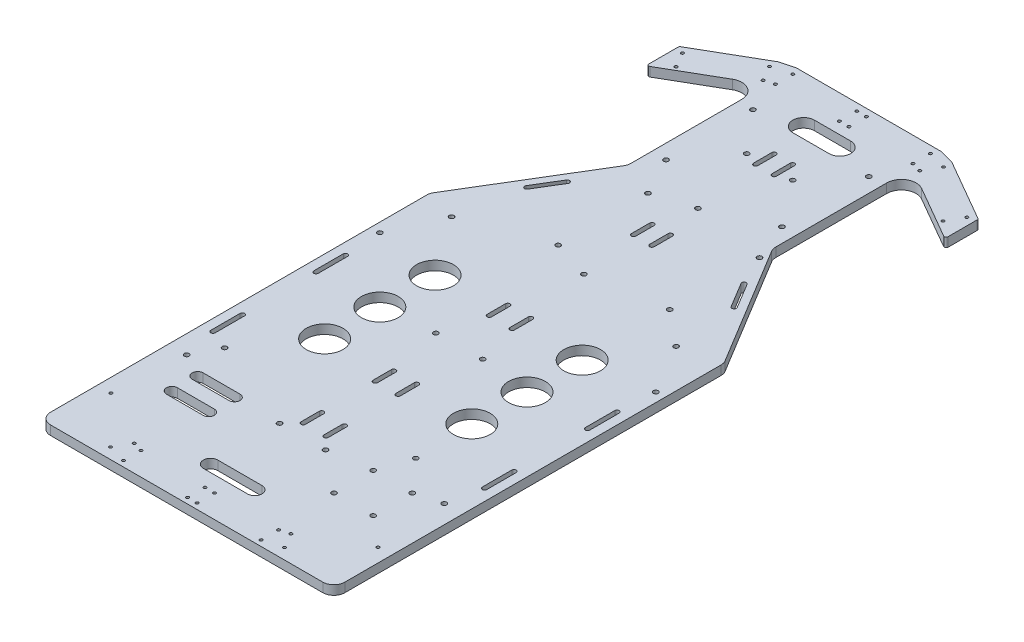
from build123d import *

# Parameters (mm, degrees)
SKETCH1_R           = 1
SKETCH1_R_2         = 1.651
SKETCH1_R_3         = 12.7
SKETCH1_R_4         = 0.999998
BOSS_EXTRUDE1_DEPTH = 6.35
FILLET1_R           = 7.62
FILLET2_R           = 1.27
FILLET3_R           = 10.16


with BuildPart() as part:
    # Sketch1 → Boss-Extrude1 (new body)
    with BuildSketch(Plane(origin=(0, 0, 0), x_dir=(1, 0, 0), z_dir=(0, 1, 0))):
        Polygon((46.413279514, 335.441646668), (-53.531215173, 335.441646668), (-63.531215173, 332.762154744), (-106.832485363, 307.762154744), (-106.832485363, 284.668143976), (-53.586720486, 315.44164674), (-53.586720486, 219.105229304), (-105.15896783, 133.894172723), (-105.15896783, -135.4993116), (98.04103217, -135.4993116), (98.04103217, 133.894172723), (46.413279514, 219.105229304), (46.413279514, 315.441646668), (99.714549703, 284.668143976), (99.714549703, 307.762154744), (56.413279514, 332.762154744), align=None)
        with Locations(Location((-95.734409151, -95.63834608, 0), (0, 0, 270))):
            Circle(SKETCH1_R, mode=Mode.SUBTRACT)
        with Locations(Location((-63.629291385, -128.030650925, 0), (0, 0, 270))):
            Circle(SKETCH1_R, mode=Mode.SUBTRACT)
        with Locations(Location((-57.629291385, -117.63834608, 0), (0, 0, 270))):
            Circle(SKETCH1_R, mode=Mode.SUBTRACT)
        with Locations(Location((-92.45896783, -46.5993116, 0), (0, 0, 270))):
            Circle(SKETCH1_R_2, mode=Mode.SUBTRACT)
        with Locations(Location((-83.55896783, -29.323827277, 0), (0, 0, 270))):
            Circle(SKETCH1_R_2, mode=Mode.SUBTRACT)
        with BuildLine():
            ThreePointArc((-75.94896783, -77.0793116), (-79.75896783, -73.2693116), (-75.94896783, -69.4593116))
            Line((-75.94896783, -69.4593116), (-50.54896783, -69.4593116))
            ThreePointArc((-50.54896783, -69.4593116), (-46.73896783, -73.2693116), (-50.54896783, -77.0793116))
            Line((-50.54896783, -77.0793116), (-75.94896783, -77.0793116))
        make_face(mode=Mode.SUBTRACT)
        with BuildLine():
            ThreePointArc((-75.94896783, -59.2993116), (-79.75896783, -55.4893116), (-75.94896783, -51.6793116))
            Line((-75.94896783, -51.6793116), (-50.54896783, -51.6793116))
            ThreePointArc((-50.54896783, -51.6793116), (-46.73896783, -55.4893116), (-50.54896783, -59.2993116))
            Line((-50.54896783, -59.2993116), (-75.94896783, -59.2993116))
        make_face(mode=Mode.SUBTRACT)
        with Locations(Location((-51.031215173, -131.540269868, 0), (0, 0, 270))):
            Circle(SKETCH1_R, mode=Mode.SUBTRACT)
        with Locations(Location((-51.031215173, -119.540269868, 0), (0, 0, 270))):
            Circle(SKETCH1_R, mode=Mode.SUBTRACT)
        with Locations(Location((-6.85896783, -131.540269868, 0), (0, 0, 270))):
            Circle(SKETCH1_R, mode=Mode.SUBTRACT)
        with Locations(Location((-6.85896783, -119.540269868, 0), (0, 0, 270))):
            Circle(SKETCH1_R, mode=Mode.SUBTRACT)
        with Locations(Location((-19.43396783, -55.499310818, 0), (0, 0, 270))):
            Circle(SKETCH1_R_2, mode=Mode.SUBTRACT)
        with BuildLine():
            ThreePointArc((-9.90896783, -47.180345554), (-11.43296783, -48.704345554), (-12.95696783, -47.180345554))
            Line((-12.95696783, -47.180345554), (-12.95696783, -34.480345554))
            ThreePointArc((-12.95696783, -34.480345554), (-11.43296783, -32.956345554), (-9.90896783, -34.480345554))
            Line((-9.90896783, -34.480345554), (-9.90896783, -47.180345554))
        make_face(mode=Mode.SUBTRACT)
        with BuildLine():
            ThreePointArc((-95.76096783, -23.585827277), (-97.28496783, -25.109827277), (-98.80896783, -23.585827277))
            Line((-98.80896783, -23.585827277), (-98.80896783, -3.265827277))
            ThreePointArc((-98.80896783, -3.265827277), (-97.28496783, -1.741827277), (-95.76096783, -3.265827277))
            Line((-95.76096783, -3.265827277), (-95.76096783, -23.585827277))
        make_face(mode=Mode.SUBTRACT)
        with BuildLine():
            ThreePointArc((-95.76096783, 47.534172723), (-97.28496783, 46.010172723), (-98.80896783, 47.534172723))
            Line((-98.80896783, 47.534172723), (-98.80896783, 67.854172723))
            ThreePointArc((-98.80896783, 67.854172723), (-97.28496783, 69.378172723), (-95.76096783, 67.854172723))
            Line((-95.76096783, 67.854172723), (-95.76096783, 47.534172723))
        make_face(mode=Mode.SUBTRACT)
        with Locations(Location((-98.80896783, 93.1006884, 0), (0, 0, 270))):
            Circle(SKETCH1_R_2, mode=Mode.SUBTRACT)
        with Locations(Location((-54.35896783, 10.5506884, 0), (0, 0, 270))):
            Circle(SKETCH1_R_3, mode=Mode.SUBTRACT)
        with BuildLine():
            ThreePointArc((-9.90896783, 2.603654446), (-11.43296783, 1.079654446), (-12.95696783, 2.603654446))
            Line((-12.95696783, 2.603654446), (-12.95696783, 15.303654446))
            ThreePointArc((-12.95696783, 15.303654446), (-11.43296783, 16.827654446), (-9.90896783, 15.303654446))
            Line((-9.90896783, 15.303654446), (-9.90896783, 2.603654446))
        make_face(mode=Mode.SUBTRACT)
        with Locations(Location((-54.35896783, 48.6506884, 0), (0, 0, 270))):
            Circle(SKETCH1_R_3, mode=Mode.SUBTRACT)
        with Locations(Location((-54.35896783, 86.7506884, 0), (0, 0, 270))):
            Circle(SKETCH1_R_3, mode=Mode.SUBTRACT)
        with Locations(Location((-19.43396783, 52.394172723, 0), (0, 0, 270))):
            Circle(SKETCH1_R_2, mode=Mode.SUBTRACT)
        with BuildLine():
            ThreePointArc((-9.90896783, 81.343654446), (-11.43296783, 79.819654446), (-12.95696783, 81.343654446))
            Line((-12.95696783, 81.343654446), (-12.95696783, 94.043654446))
            ThreePointArc((-12.95696783, 94.043654446), (-11.43296783, 95.567654446), (-9.90896783, 94.043654446))
            Line((-9.90896783, 94.043654446), (-9.90896783, 81.343654446))
        make_face(mode=Mode.SUBTRACT)
        with Locations(Location((-0.25896783, -131.540269868, 0), (0, 0, 270))):
            Circle(SKETCH1_R, mode=Mode.SUBTRACT)
        with Locations(Location((-0.25896783, -119.540269868, 0), (0, 0, 270))):
            Circle(SKETCH1_R, mode=Mode.SUBTRACT)
        with BuildLine():
            ThreePointArc((-18.79896783, -108.7493116), (-23.79896783, -103.7493116), (-18.79896783, -98.7493116))
            Line((-18.79896783, -98.7493116), (11.68103217, -98.7493116))
            ThreePointArc((11.68103217, -98.7493116), (16.68103217, -103.7493116), (11.68103217, -108.7493116))
            Line((11.68103217, -108.7493116), (-18.79896783, -108.7493116))
        make_face(mode=Mode.SUBTRACT)
        with Locations(Location((43.919071676, -131.540269868, 0), (0, 0, 270))):
            Circle(SKETCH1_R, mode=Mode.SUBTRACT)
        with Locations(Location((43.913279514, -119.540269868, 0), (0, 0, 270))):
            Circle(SKETCH1_R, mode=Mode.SUBTRACT)
        with Locations(Location((41.040965028, -78.3493116, 0), (0, 0, 270))):
            Circle(SKETCH1_R_2, mode=Mode.SUBTRACT)
        with Locations(Location((12.31603217, -55.499310818, 0), (0, 0, 270))):
            Circle(SKETCH1_R_2, mode=Mode.SUBTRACT)
        with BuildLine():
            Line((5.83903217, -34.480345554), (5.83903217, -47.180345554))
            ThreePointArc((5.83903217, -47.180345554), (4.31503217, -48.704345554), (2.79103217, -47.180345554))
            Line((2.79103217, -47.180345554), (2.79103217, -34.480345554))
            ThreePointArc((2.79103217, -34.480345554), (4.31503217, -32.956345554), (5.83903217, -34.480345554))
        make_face(mode=Mode.SUBTRACT)
        with Locations(Location((41.040965028, -51.3493116, 0), (0, 0, 270))):
            Circle(SKETCH1_R_2, mode=Mode.SUBTRACT)
        with Locations(Location((56.511355725, -128.030650925, 0), (0, 0, 270))):
            Circle(SKETCH1_R, mode=Mode.SUBTRACT)
        with Locations(Location((50.511355725, -117.63834608, 0), (0, 0, 270))):
            Circle(SKETCH1_R, mode=Mode.SUBTRACT)
        with Locations(Location((68.040965028, -78.3493116, 0), (0, 0, 270))):
            Circle(SKETCH1_R_2, mode=Mode.SUBTRACT)
        with Locations(Location((88.616473491, -95.63834608, 0), (0, 0, 270))):
            Circle(SKETCH1_R, mode=Mode.SUBTRACT)
        with Locations(Location((68.040965028, -51.3493116, 0), (0, 0, 270))):
            Circle(SKETCH1_R_2, mode=Mode.SUBTRACT)
        with Locations(Location((48.44103217, -29.323827277, 0), (0, 0, 270))):
            Circle(SKETCH1_R_2, mode=Mode.SUBTRACT)
        with Locations(Location((85.34103217, -46.5993116, 0), (0, 0, 270))):
            Circle(SKETCH1_R_2, mode=Mode.SUBTRACT)
        with BuildLine():
            Line((5.83903217, 15.303654446), (5.83903217, 2.603654446))
            ThreePointArc((5.83903217, 2.603654446), (4.31503217, 1.079654446), (2.79103217, 2.603654446))
            Line((2.79103217, 2.603654446), (2.79103217, 15.303654446))
            ThreePointArc((2.79103217, 15.303654446), (4.31503217, 16.827654446), (5.83903217, 15.303654446))
        make_face(mode=Mode.SUBTRACT)
        with Locations(Location((47.24103217, 10.5506884, 0), (0, 0, 270))):
            Circle(SKETCH1_R_3, mode=Mode.SUBTRACT)
        with Locations(Location((12.31603217, 52.980268579, 0), (0, 0, 270))):
            Circle(SKETCH1_R_2, mode=Mode.SUBTRACT)
        with BuildLine():
            Line((5.83903217, 94.043654446), (5.83903217, 81.343654446))
            ThreePointArc((5.83903217, 81.343654446), (4.31503217, 79.819654446), (2.79103217, 81.343654446))
            Line((2.79103217, 81.343654446), (2.79103217, 94.043654446))
            ThreePointArc((2.79103217, 94.043654446), (4.31503217, 95.567654446), (5.83903217, 94.043654446))
        make_face(mode=Mode.SUBTRACT)
        with Locations(Location((47.24103217, 48.6506884, 0), (0, 0, 270))):
            Circle(SKETCH1_R_3, mode=Mode.SUBTRACT)
        with Locations(Location((47.24103217, 86.7506884, 0), (0, 0, 270))):
            Circle(SKETCH1_R_3, mode=Mode.SUBTRACT)
        with BuildLine():
            Line((91.69103217, -3.265827277), (91.69103217, -23.585827277))
            ThreePointArc((91.69103217, -23.585827277), (90.16703217, -25.109827277), (88.64303217, -23.585827277))
            Line((88.64303217, -23.585827277), (88.64303217, -3.265827277))
            ThreePointArc((88.64303217, -3.265827277), (90.16703217, -1.741827277), (91.69103217, -3.265827277))
        make_face(mode=Mode.SUBTRACT)
        with BuildLine():
            Line((91.69103217, 67.854172723), (91.69103217, 47.534172723))
            ThreePointArc((91.69103217, 47.534172723), (90.16703217, 46.010172723), (88.64303217, 47.534172723))
            Line((88.64303217, 47.534172723), (88.64303217, 67.854172723))
            ThreePointArc((88.64303217, 67.854172723), (90.16703217, 69.378172723), (91.69103217, 67.854172723))
        make_face(mode=Mode.SUBTRACT)
        with Locations(Location((91.690899407, 93.1006884, 0), (0, 0, 270))):
            Circle(SKETCH1_R_2, mode=Mode.SUBTRACT)
        with Locations(Location((-83.55896783, 127.394172723, 0), (0, 0, 270))):
            Circle(SKETCH1_R_2, mode=Mode.SUBTRACT)
        with BuildLine():
            ThreePointArc((-73.818898227, 170.133063235), (-75.911798962, 169.618360881), (-76.426501316, 171.711261616))
            Line((-76.426501316, 171.711261616), (-65.90517878, 189.095282212))
            ThreePointArc((-65.90517878, 189.095282212), (-63.812278045, 189.609984566), (-63.29757569, 187.517083831))
            Line((-63.29757569, 187.517083831), (-73.818898227, 170.133063235))
        make_face(mode=Mode.SUBTRACT)
        with Locations(Location((-29.818425833, 147.225411442, 0), (0, 0, 270))):
            Circle(SKETCH1_R_2, mode=Mode.SUBTRACT)
        with Locations(Location((-29.818425833, 209.225411442, 0), (0, 0, 270))):
            Circle(SKETCH1_R_2, mode=Mode.SUBTRACT)
        with BuildLine():
            ThreePointArc((-8.38496783, 179.387654446), (-9.90896783, 177.863654446), (-11.43296783, 179.387654446))
            Line((-11.43296783, 179.387654446), (-11.43296783, 192.087654446))
            ThreePointArc((-11.43296783, 192.087654446), (-9.90896783, 193.611654446), (-8.38496783, 192.087654446))
            Line((-8.38496783, 192.087654446), (-8.38496783, 179.387654446))
        make_face(mode=Mode.SUBTRACT)
        with Locations(Location((-101.734409151, 304.932027725, 0), (0, 0, 270))):
            Circle(SKETCH1_R_4, mode=Mode.SUBTRACT)
        with Locations(Location((-95.734409151, 294.539722879, 0), (0, 0, 270))):
            Circle(SKETCH1_R, mode=Mode.SUBTRACT)
        with Locations(Location((-57.629291385, 316.539722879, 0), (0, 0, 270))):
            Circle(SKETCH1_R, mode=Mode.SUBTRACT)
        with Locations(Location((-63.629291385, 326.932027725, 0), (0, 0, 270))):
            Circle(SKETCH1_R, mode=Mode.SUBTRACT)
        with Locations(Location((-43.553175668, 235.441646668, 0), (0, 0, 270))):
            Circle(SKETCH1_R_2, mode=Mode.SUBTRACT)
        with Locations(Location((-19.43396783, 267.000689182, 0), (0, 0, 270))):
            Circle(SKETCH1_R_2, mode=Mode.SUBTRACT)
        with BuildLine():
            ThreePointArc((-8.422984205, 263.689995521), (-9.924635304, 262.191654446), (-11.422976379, 263.693305545))
            Line((-11.422976379, 263.693305545), (-11.408963917, 276.393297815))
            ThreePointArc((-11.408963917, 276.393297815), (-9.907312818, 277.89163889), (-8.408971743, 276.389987791))
            Line((-8.408971743, 276.389987791), (-8.422984205, 263.689995521))
        make_face(mode=Mode.SUBTRACT)
        with Locations(Location((-43.580928324, 295.441646668, 0), (0, 0, 270))):
            Circle(SKETCH1_R_2, mode=Mode.SUBTRACT)
        with Locations(Location((-51.031215173, 318.441646668, 0), (0, 0, 270))):
            Circle(SKETCH1_R, mode=Mode.SUBTRACT)
        with Locations(Location((-51.031215173, 330.441646668, 0), (0, 0, 270))):
            Circle(SKETCH1_R, mode=Mode.SUBTRACT)
        with Locations(Location((-6.85896783, 318.441646668, 0), (0, 0, 270))):
            Circle(SKETCH1_R, mode=Mode.SUBTRACT)
        with Locations(Location((-6.85896783, 330.441646668, 0), (0, 0, 270))):
            Circle(SKETCH1_R, mode=Mode.SUBTRACT)
        with Locations(Location((-3.55896783, 138.713752287, 0), (0, 0, 270))):
            Circle(SKETCH1_R_2, mode=Mode.SUBTRACT)
        with Locations(Location((47.181574167, 147.225411442, 0), (0, 0, 270))):
            Circle(SKETCH1_R_2, mode=Mode.SUBTRACT)
        with BuildLine():
            Line((4.31503217, 192.087654446), (4.31503217, 179.387654446))
            ThreePointArc((4.31503217, 179.387654446), (2.79103217, 177.863654446), (1.26703217, 179.387654446))
            Line((1.26703217, 179.387654446), (1.26703217, 192.087654446))
            ThreePointArc((1.26703217, 192.087654446), (2.79103217, 193.611654446), (4.31503217, 192.087654446))
        make_face(mode=Mode.SUBTRACT)
        with Locations(Location((-3.55896783, 217.453752287, 0), (0, 0, 270))):
            Circle(SKETCH1_R_2, mode=Mode.SUBTRACT)
        with Locations(Location((47.181574167, 209.225411442, 0), (0, 0, 270))):
            Circle(SKETCH1_R_2, mode=Mode.SUBTRACT)
        with Locations(Location((71.44103217, 127.394172723, 0), (0, 0, 270))):
            Circle(SKETCH1_R_2, mode=Mode.SUBTRACT)
        with BuildLine():
            Line((58.78724312, 189.095282212), (69.308565656, 171.711261616))
            ThreePointArc((69.308565656, 171.711261616), (68.793863302, 169.618360881), (66.700962567, 170.133063235))
            Line((66.700962567, 170.133063235), (56.17964003, 187.517083831))
            ThreePointArc((56.17964003, 187.517083831), (56.694342385, 189.609984566), (58.78724312, 189.095282212))
        make_face(mode=Mode.SUBTRACT)
        with BuildLine():
            Line((4.291028257, 276.393297815), (4.305040719, 263.693305545))
            ThreePointArc((4.305040719, 263.693305545), (2.806699644, 262.191654446), (1.305048545, 263.689995521))
            Line((1.305048545, 263.689995521), (1.291036083, 276.389987791))
            ThreePointArc((1.291036083, 276.389987791), (2.789377158, 277.89163889), (4.291028257, 276.393297815))
        make_face(mode=Mode.SUBTRACT)
        with Locations(Location((12.31603217, 267.000689182, 0), (0, 0, 270))):
            Circle(SKETCH1_R_2, mode=Mode.SUBTRACT)
        with Locations(Location((36.44103217, 235.441646668, 0), (0, 0, 270))):
            Circle(SKETCH1_R_2, mode=Mode.SUBTRACT)
        with BuildLine():
            ThreePointArc((-16.05896783, 295.441646668), (-23.55896783, 302.941646668), (-16.05896783, 310.441646668))
            Line((-16.05896783, 310.441646668), (8.94103217, 310.441646668))
            ThreePointArc((8.94103217, 310.441646668), (16.44103217, 302.941646668), (8.94103217, 295.441646668))
            Line((8.94103217, 295.441646668), (-16.05896783, 295.441646668))
        make_face(mode=Mode.SUBTRACT)
        with Locations(Location((-0.25896783, 318.441646668, 0), (0, 0, 270))):
            Circle(SKETCH1_R, mode=Mode.SUBTRACT)
        with Locations(Location((-0.25896783, 330.441646668, 0), (0, 0, 270))):
            Circle(SKETCH1_R, mode=Mode.SUBTRACT)
        with Locations(Location((36.419071676, 295.441646668, 0), (0, 0, 270))):
            Circle(SKETCH1_R_2, mode=Mode.SUBTRACT)
        with Locations(Location((43.913279514, 318.441646668, 0), (0, 0, 270))):
            Circle(SKETCH1_R, mode=Mode.SUBTRACT)
        with Locations(Location((43.919071676, 330.441646668, 0), (0, 0, 270))):
            Circle(SKETCH1_R, mode=Mode.SUBTRACT)
        with Locations(Location((50.511355725, 316.539722879, 0), (0, 0, 270))):
            Circle(SKETCH1_R, mode=Mode.SUBTRACT)
        with Locations(Location((56.511355725, 326.932027725, 0), (0, 0, 270))):
            Circle(SKETCH1_R, mode=Mode.SUBTRACT)
        with Locations(Location((88.616473491, 294.539722879, 0), (0, 0, 270))):
            Circle(SKETCH1_R, mode=Mode.SUBTRACT)
        with Locations(Location((94.616473491, 304.932027725, 0), (0, 0, 270))):
            Circle(SKETCH1_R_4, mode=Mode.SUBTRACT)
    extrude(amount=BOSS_EXTRUDE1_DEPTH)

    # Fillet1
    fillet1_edges = [part.edges().sort_by_distance(p)[0] for p in [
        (46.413279514, 3.175, -219.105229304),
        (98.04103217, 3.175, -133.894172723),
        (98.04103217, 3.175, 135.4993116),
        (-105.15896783, 3.175, 135.4993116),
        (-105.15896783, 3.175, -133.894172723),
        (-53.586720486, 3.175, -219.105229304),
    ]]
    fillet(fillet1_edges, radius=FILLET1_R)

    # Fillet2
    fillet2_edges = [part.edges().sort_by_distance(p)[0] for p in [
        (-106.832485363, 3.175, -284.668143976),
        (-106.832485363, 3.175, -307.762154744),
        (-63.531215173, 3.175, -332.762154744),
        (-53.531215173, 3.175, -335.441646668),
        (46.413279514, 3.175, -335.441646668),
        (56.413279514, 3.175, -332.762154744),
        (99.714549703, 3.175, -307.762154744),
        (99.714549703, 3.175, -284.668143976),
    ]]
    fillet(fillet2_edges, radius=FILLET2_R)

    # Fillet3
    fillet3_edges = [part.edges().sort_by_distance(p)[0] for p in [
        (46.413279514, 3.175, -315.441646668),
        (-53.586720486, 3.175, -315.44164674),
    ]]
    fillet(fillet3_edges, radius=FILLET3_R)


solid = part.part
